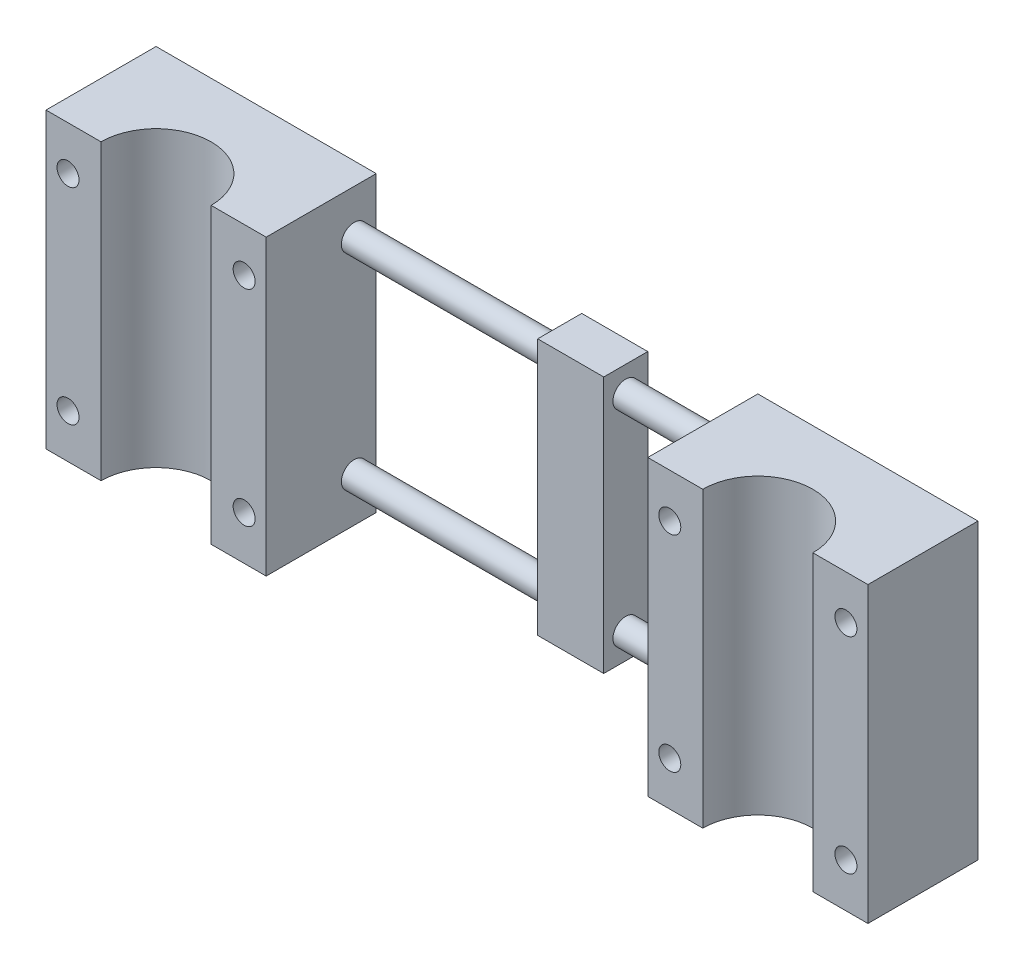
from build123d import *

# Parameters (mm, degrees)
SKETCH1_W           = 30
SKETCH1_H           = 40
BOSS_EXTRUDE1_DEPTH = 15
CUT_EXTRUDE1_DEPTH  = 49
SKETCH3_R           = 1.5
CUT_EXTRUDE2_DEPTH  = 49
SKETCH4_R           = 1.75
BOSS_EXTRUDE2_DEPTH = 28
SKETCH5_W           = 6
SKETCH5_H           = 35
BOSS_EXTRUDE3_DEPTH = 9
SKETCH6_R           = 1.75
BOSS_EXTRUDE4_DEPTH = 15
SKETCH7_W           = 15
SKETCH7_H           = 40
BOSS_EXTRUDE6_DEPTH = 30
CUT_EXTRUDE3_DEPTH  = 59
SKETCH10_R          = 1.5
CUT_EXTRUDE4_DEPTH  = 59


with BuildPart() as part:
    # Sketch1 → Boss-Extrude1 (new body)
    with BuildSketch(Plane.XY):
        with Locations((15, 20)):
            Rectangle(SKETCH1_W, SKETCH1_H)
    extrude(amount=BOSS_EXTRUDE1_DEPTH)

    # Sketch2 → Cut-Extrude1 (cut)
    with BuildSketch(Plane(origin=(0, 40, 0), x_dir=(1, 0, 0), z_dir=(0, 1, 0))):
        with BuildLine():
            Line((7.5, -15), (22.5, -15))
            ThreePointArc((22.5, -15), (15, -7.5), (7.5, -15))
        make_face()
    extrude(amount=-CUT_EXTRUDE1_DEPTH, mode=Mode.SUBTRACT)

    # Sketch3 → Cut-Extrude2 (cut)
    with BuildSketch(Plane.XY.offset(15)):
        with Locations((3, 34)):
            Circle(SKETCH3_R)
        with Locations((3, 6)):
            Circle(SKETCH3_R)
        with Locations((27, 34)):
            Circle(SKETCH3_R)
        with Locations((27, 6)):
            Circle(SKETCH3_R)
    extrude(amount=-CUT_EXTRUDE2_DEPTH, mode=Mode.SUBTRACT)

    # Sketch4 → Boss-Extrude2 (add)
    with BuildSketch(Plane(origin=(30, 0, 0), x_dir=(0, 0, -1), z_dir=(1, 0, 0))):
        with Locations(Location((-3, 34, 0), (0, 0, 180))):
            Circle(SKETCH4_R)
        with Locations(Location((-3, 6, 0), (0, 0, 180))):
            Circle(SKETCH4_R)
    extrude(amount=BOSS_EXTRUDE2_DEPTH)

    # Sketch5 → Boss-Extrude3 (add)
    with BuildSketch(Plane(origin=(58, 0, 0), x_dir=(0, 0, -1), z_dir=(1, 0, 0))):
        with Locations((-3, 20)):
            Rectangle(SKETCH5_W, SKETCH5_H)
    extrude(amount=BOSS_EXTRUDE3_DEPTH)

    # Sketch6 → Boss-Extrude4 (add)
    with BuildSketch(Plane(origin=(67, 0, 0), x_dir=(0, 0, -1), z_dir=(1, 0, 0))):
        with Locations(Location((-3, 34, 0), (0, 0, 180))):
            Circle(SKETCH6_R)
        with Locations(Location((-3, 6, 0), (0, 0, 180))):
            Circle(SKETCH6_R)
    extrude(amount=BOSS_EXTRUDE4_DEPTH)

    # Sketch7 → Boss-Extrude6 (add)
    with BuildSketch(Plane(origin=(82, 0, 0), x_dir=(0, 0, -1), z_dir=(1, 0, 0))):
        with Locations((-7.5, 20)):
            Rectangle(SKETCH7_W, SKETCH7_H)
    extrude(amount=BOSS_EXTRUDE6_DEPTH)

    # Sketch9 → Cut-Extrude3 (cut)
    with BuildSketch(Plane(origin=(0, 40, 0), x_dir=(1, 0, 0), z_dir=(0, 1, 0))):
        with BuildLine():
            Line((89.5, -15), (104.5, -15))
            ThreePointArc((104.5, -15), (97, -7.5), (89.5, -15))
        make_face()
    extrude(amount=-CUT_EXTRUDE3_DEPTH, mode=Mode.SUBTRACT)

    # Sketch10 → Cut-Extrude4 (cut)
    with BuildSketch(Plane.XY.offset(15)):
        with Locations((85, 34)):
            Circle(SKETCH10_R)
        with Locations((109, 34)):
            Circle(SKETCH10_R)
        with Locations((109, 6)):
            Circle(SKETCH10_R)
        with Locations((85, 6)):
            Circle(SKETCH10_R)
    extrude(amount=-CUT_EXTRUDE4_DEPTH, mode=Mode.SUBTRACT)


solid = part.part
